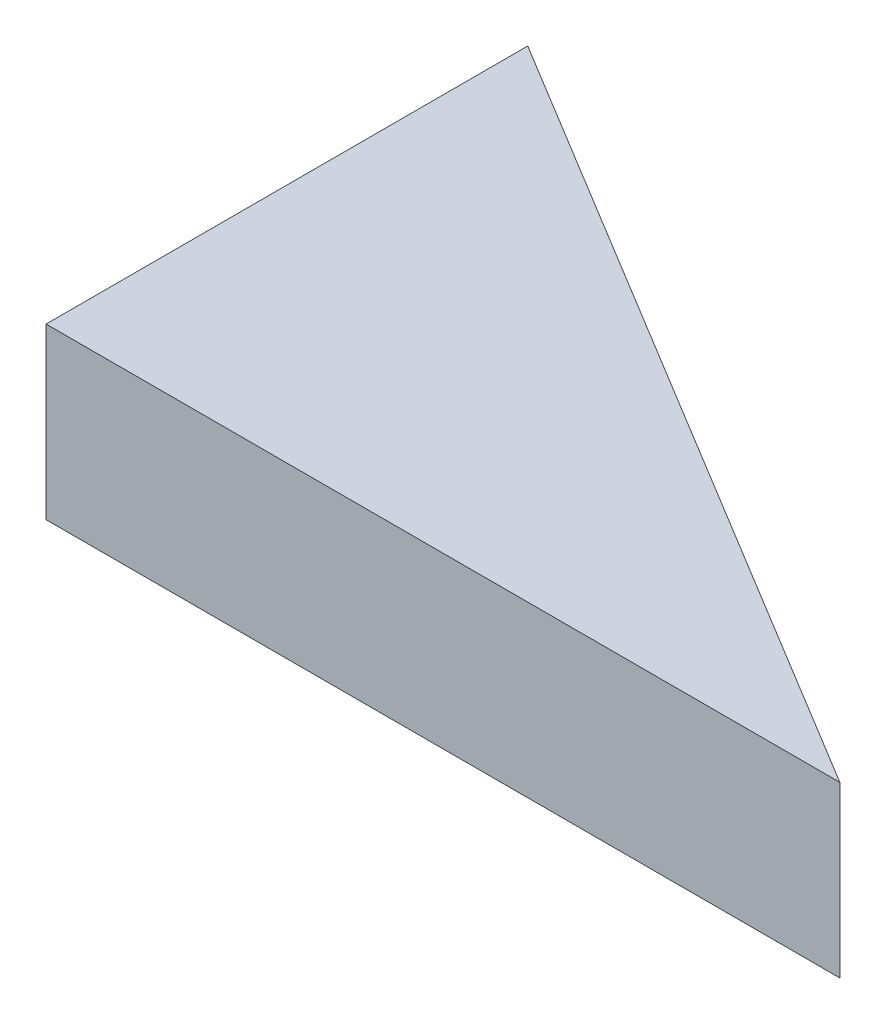
from build123d import *

# Parameters (mm, degrees)
BOSS_EXTRUDE1_DEPTH = 48.26


with BuildPart() as part:
    # Sketch1 → Boss-Extrude1 (new body)
    with BuildSketch(Plane(origin=(0, 0, 0), x_dir=(1, 0, 0), z_dir=(0, 1, 0))):
        Polygon((0, 0), (0, 137.16), (226.06, 0), align=None)
    extrude(amount=BOSS_EXTRUDE1_DEPTH)


solid = part.part
